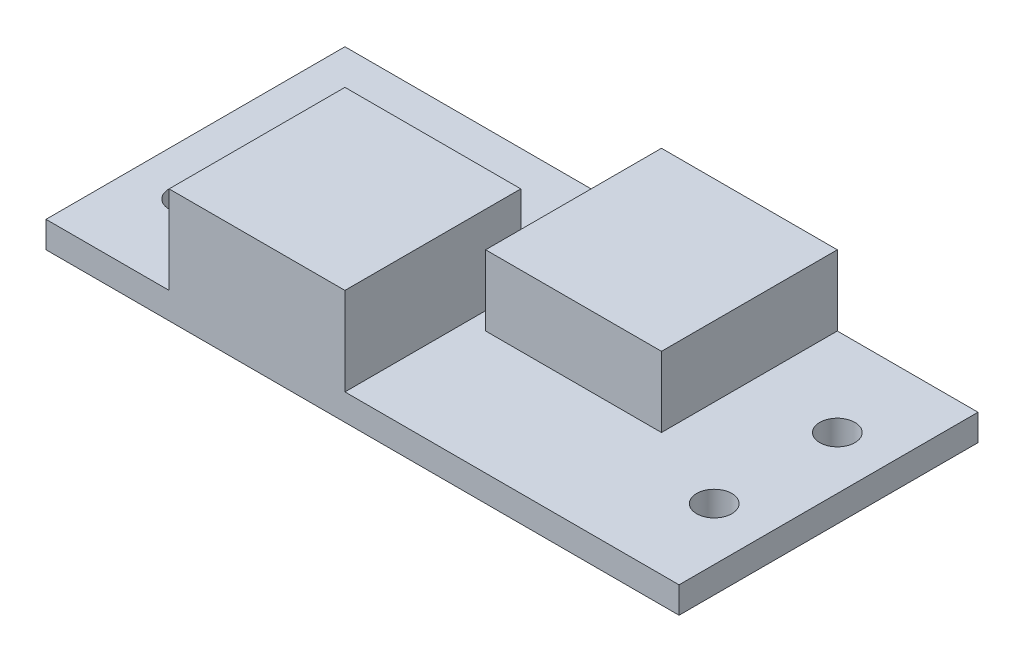
from build123d import *

# Parameters (mm, degrees)
SKETCH1_W                 = 36
SKETCH1_H                 = 17
BOSS_EXTRUDE1_DEPTH       = 1.5
SKETCH2_W                 = 10
SKETCH2_H                 = 10
BOSS_EXTRUDE2_DEPTH       = 4
SKETCH3_W                 = 10
SKETCH3_H                 = 10
BOSS_EXTRUDE3_DEPTH       = 5
SKETCH4_R                 = 1
CUT_EXTRUDE1_DEPTH        = 5
LPATTERN1_COUNT           = 2
LPATTERN1_PITCH           = 7
LPATTERN2_COUNT           = 2
LPATTERN2_PITCH           = 30
LPATTERN2_COPY_1_SKETCH_R = 1
LPATTERN2_COPY_1_DEPTH    = 5


with BuildPart() as part:
    # Sketch1 → Boss-Extrude1 (new body)
    with BuildSketch(Plane(origin=(0, 0, 0), x_dir=(1, 0, 0), z_dir=(0, 1, 0))):
        with Locations((18, -8.5)):
            Rectangle(SKETCH1_W, SKETCH1_H)
    extrude(amount=BOSS_EXTRUDE1_DEPTH)

    # Sketch2 → Boss-Extrude2 (add)
    with BuildSketch(Plane(origin=(0, 1.5, 0), x_dir=(1, 0, 0), z_dir=(0, 1, 0))):
        with Locations((23, -5)):
            Rectangle(SKETCH2_W, SKETCH2_H)
    extrude(amount=BOSS_EXTRUDE2_DEPTH)

    # Sketch3 → Boss-Extrude3 (add)
    with BuildSketch(Plane(origin=(0, 1.5, 0), x_dir=(1, 0, 0), z_dir=(0, 1, 0))):
        with Locations((12, -12)):
            Rectangle(SKETCH3_W, SKETCH3_H)
    extrude(amount=BOSS_EXTRUDE3_DEPTH)

    # Sketch4 → Cut-Extrude1 (cut)
    with BuildSketch(Plane(origin=(0, 1.5, 0), x_dir=(1, 0, 0), z_dir=(0, 1, 0))):
        with Locations(Location((3, -5, 0), (0, 0, 270))):
            Circle(SKETCH4_R)
    cut_extrude1 = extrude(amount=-CUT_EXTRUDE1_DEPTH, mode=Mode.SUBTRACT)

    # LPattern1: Cut-Extrude1 ×2
    with Locations(*[(0, 0, i * LPATTERN1_PITCH) for i in range(1, LPATTERN1_COUNT)]):
        add(cut_extrude1, mode=Mode.SUBTRACT)

    # LPattern2: Cut-Extrude1 ×2
    with Locations(*[(i * LPATTERN2_PITCH, 0, 0) for i in range(1, LPATTERN2_COUNT)]):
        add(cut_extrude1, mode=Mode.SUBTRACT)

    # LPattern2 copy 1 sketch → LPattern2 copy 1 (cut)
    with BuildSketch(Plane(origin=(30, 1.5, 7), x_dir=(1, 0, 0), z_dir=(0, 1, 0))):
        with Locations(Location((3, -5, 0), (0, 0, 270))):
            Circle(LPATTERN2_COPY_1_SKETCH_R)
    extrude(amount=-LPATTERN2_COPY_1_DEPTH, mode=Mode.SUBTRACT)


solid = part.part
